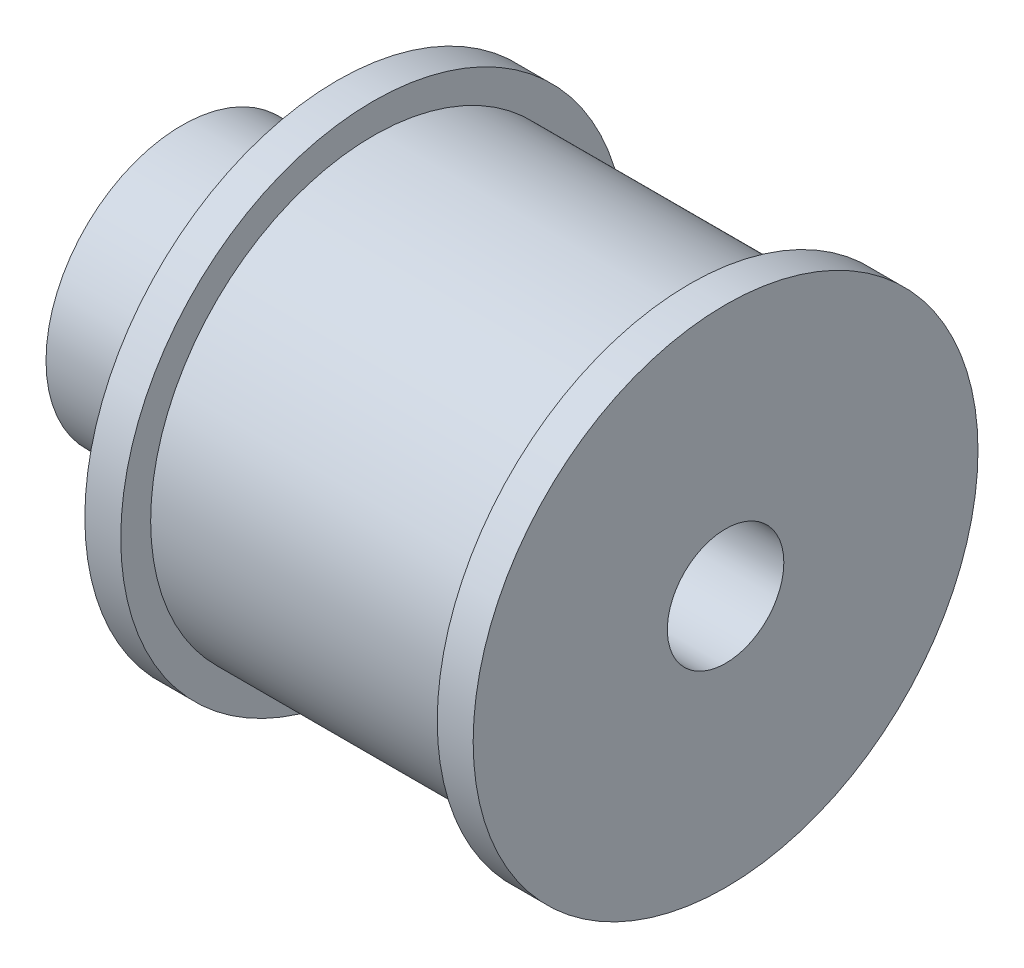
from build123d import *

# Parameters (mm, degrees)
F_6_0_6_DIAMETER_HOLE2_D     = 6
F_6_0_6_DIAMETER_HOLE2_DEPTH = 24
F_6_0_6_DIAMETER_HOLE2_TIP   = 1.802581857


with BuildPart() as part:
    # Sketch1 → Revolve1 (revolve)
    with BuildSketch(Plane(origin=(0, 0, 0), x_dir=(1, 0, 0), z_dir=(0, 1, 0))):
        Polygon((0, -11.46), (-8.15, -11.46), (-8.15, -13), (-10, -13), (-10, -7), (-18, -7), (-18, 0), (-10, 0), (10, 0), (10, -13), (8.15, -13), (8.15, -11.46), align=None)
    revolve(axis=Axis((-10, 0, 0), (1, 0, 0)))

    # Ø6.0 (6) Diameter Hole2
    with Locations(Plane(origin=(10, 0, 0), x_dir=(0, 0, -1), z_dir=(1, 0, 0))):
        with Locations((0, 0)):
            Hole(F_6_0_6_DIAMETER_HOLE2_D / 2, depth=F_6_0_6_DIAMETER_HOLE2_DEPTH)
            with Locations((0, 0, -(F_6_0_6_DIAMETER_HOLE2_DEPTH + F_6_0_6_DIAMETER_HOLE2_TIP / 2))):  # 118° drill point
                Cone(0, F_6_0_6_DIAMETER_HOLE2_D / 2, F_6_0_6_DIAMETER_HOLE2_TIP, mode=Mode.SUBTRACT)


solid = part.part
